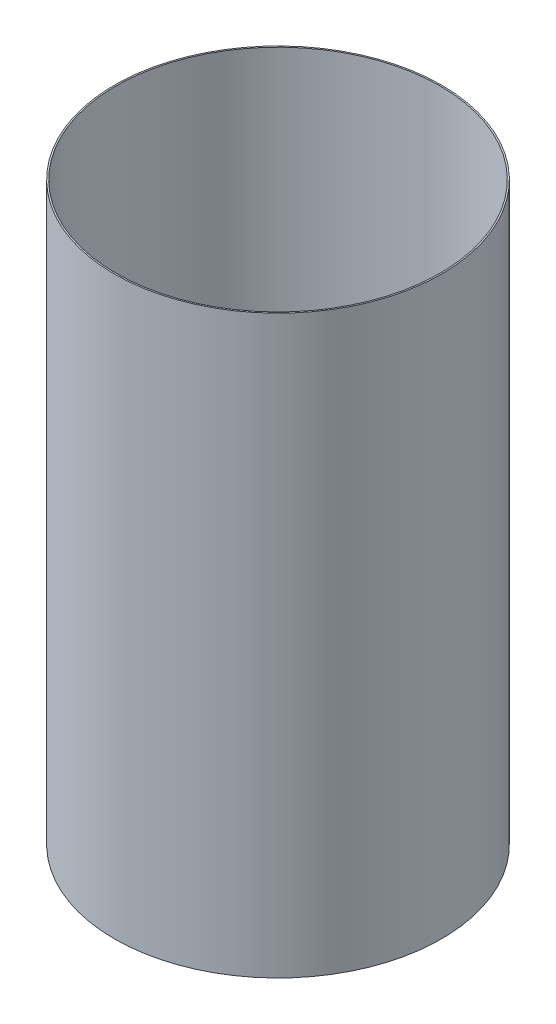
from build123d import *

# Parameters (mm, degrees)
SKETCH_1_R      = 222.5
EXTRUDE_1_DEPTH = 790
SHELL_1_T       = 2


with BuildPart() as part:
    # Эскиз1 → Бобышка-Вытянуть1 (new body)
    with BuildSketch(Plane(origin=(0, 0, 0), x_dir=(1, 0, 0), z_dir=(0, 1, 0))):
        with Locations(Location((0, 0, 0), (0, 0, 90))):
            Circle(SKETCH_1_R)
    extrude(amount=EXTRUDE_1_DEPTH)

    # Оболочка1
    shell_1_openings = [part.faces().sort_by_distance(p)[0] for p in [
        (0, 0, 0),
        (0, 790, 0),
    ]]
    offset(amount=SHELL_1_T, openings=shell_1_openings, kind=Kind.INTERSECTION)


solid = part.part
